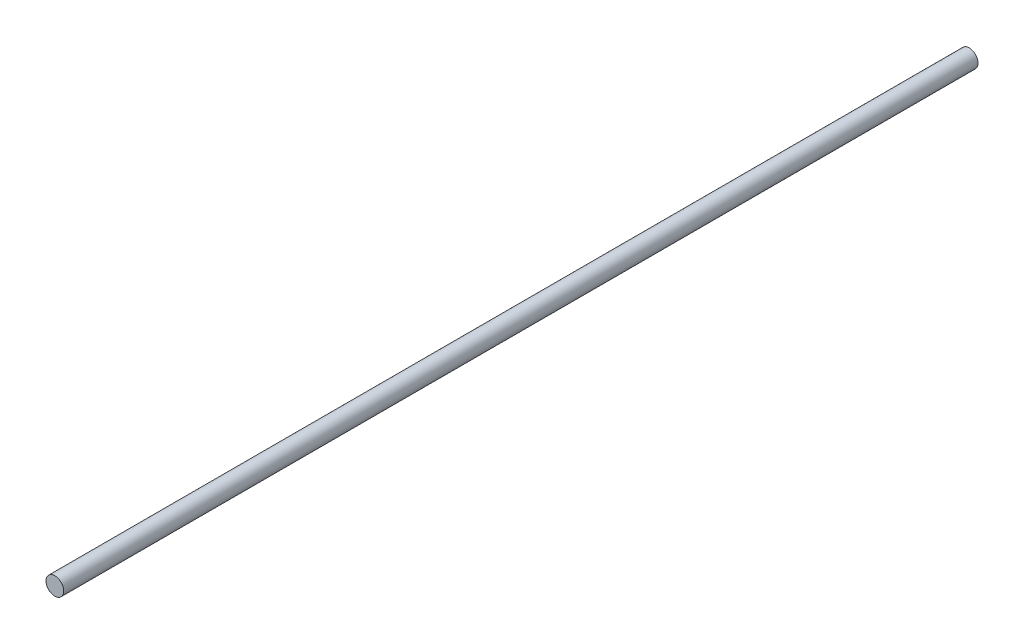
from build123d import *

# Parameters (mm, degrees)
SKETCH1_R           = 2
BOSS_EXTRUDE1_DEPTH = 207


with BuildPart() as part:
    # Sketch1 → Boss-Extrude1 (new body)
    with BuildSketch(Plane.XY):
        with Locations(Location((0, 0, 0), (0, 0, 180))):
            Circle(SKETCH1_R)
    extrude(amount=BOSS_EXTRUDE1_DEPTH)


solid = part.part
